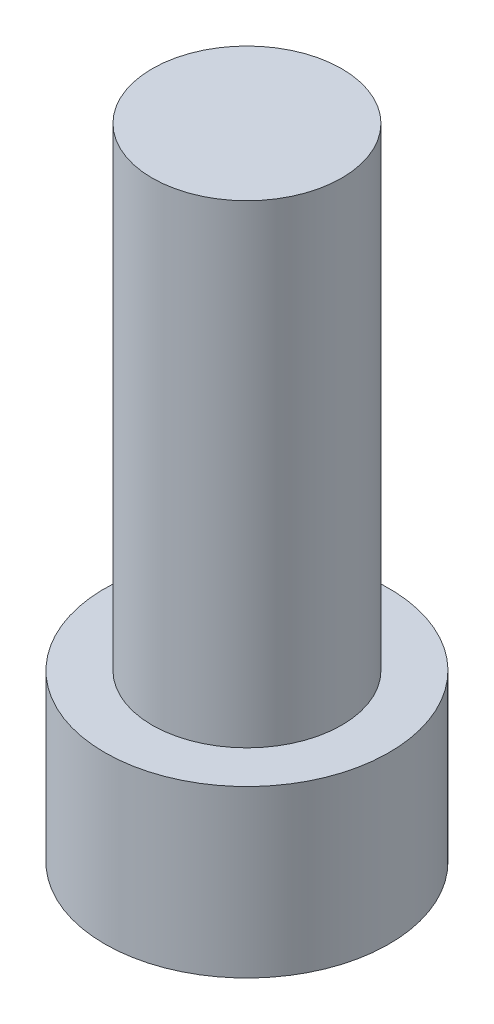
from build123d import *

# Parameters (mm, degrees)
SKETCH1_R           = 6
BOSS_EXTRUDE1_DEPTH = 7
SKETCH2_R           = 4
BOSS_EXTRUDE2_DEPTH = 20


with BuildPart() as part:
    # Sketch1 → Boss-Extrude1 (new body)
    with BuildSketch(Plane(origin=(0, 0, 0), x_dir=(1, 0, 0), z_dir=(0, 1, 0))):
        with Locations(Location((0, 0, 0), (0, 0, 270))):
            Circle(SKETCH1_R)
    extrude(amount=BOSS_EXTRUDE1_DEPTH)

    # Sketch2 → Boss-Extrude2 (add)
    with BuildSketch(Plane(origin=(0, 7, 0), x_dir=(-1, 0, 0), z_dir=(0, 1, 0))):
        with Locations(Location((0, 0, 0), (0, 0, 90))):
            Circle(SKETCH2_R)
    extrude(amount=BOSS_EXTRUDE2_DEPTH)


solid = part.part
